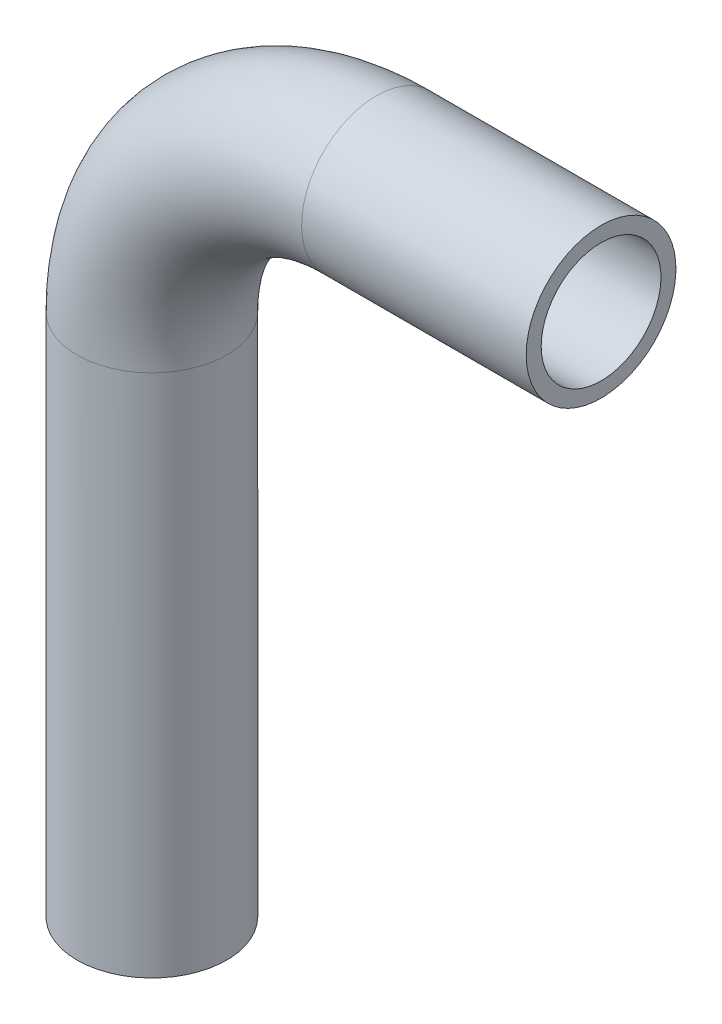
from build123d import *

# Parameters (mm, degrees)
SKETCH1_R   = 12.7
SKETCH1_R_2 = 10.16


with BuildPart() as part:
    # Sweep1: sweep along a path in Sketch3
    with BuildLine(Plane.XY) as sweep1_path:
        Line((0, 0), (0, 88.9))
        ThreePointArc((0, 88.9), (11.159231637, 115.840768363), (38.1, 127))
        Line((38.1, 127), (76.2, 127))
    # Sketch1 → Sweep1 (sweep)
    with BuildSketch(Plane(origin=(0, 0, 0), x_dir=(1, 0, 0), z_dir=(0, 1, 0))):
        Circle(SKETCH1_R)
        Circle(SKETCH1_R_2, mode=Mode.SUBTRACT)
    sweep(path=sweep1_path.line)


solid = part.part
